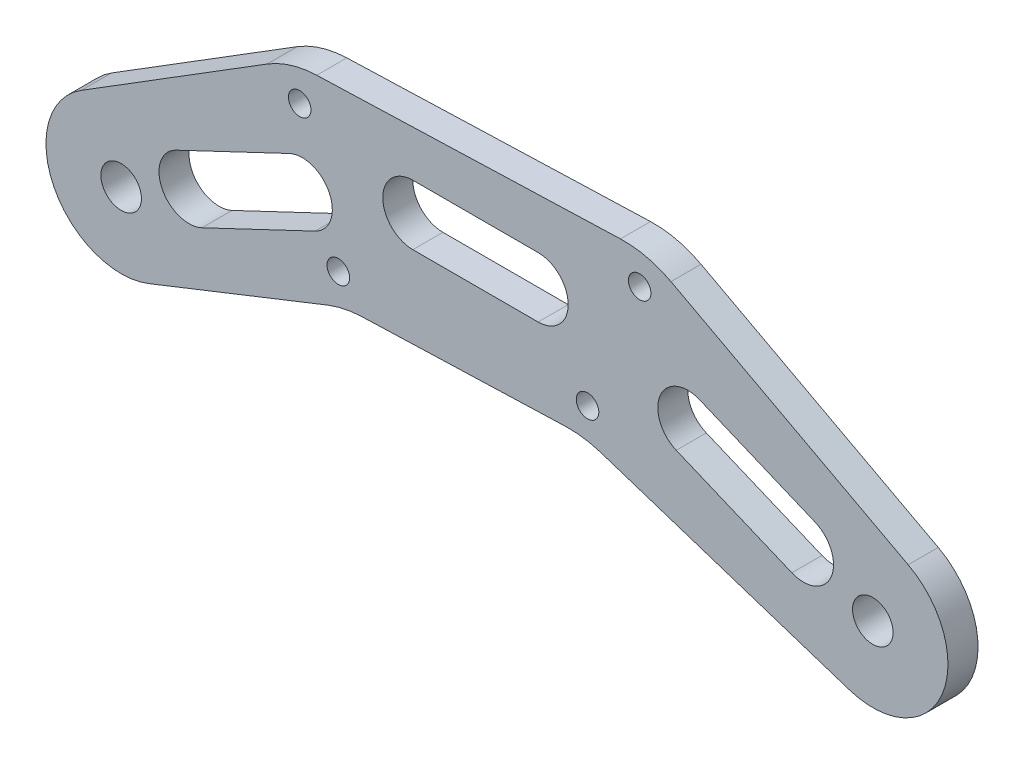
from build123d import *

# Parameters (mm, degrees)
SKETCH1_R                = 4.05
BOSS_EXTRUDE1_DEPTH      = 6
M4_CLEARANCE_HOLE1_D     = 4.5
M4_CLEARANCE_HOLE1_DEPTH = 80.96
M4_CLEARANCE_HOLE1_TIP   = 1.351936393
CUT_EXTRUDE1_DEPTH       = 103.314309644


with BuildPart() as part:
    # Sketch1 → Boss-Extrude1 (new body)
    with BuildSketch(Plane.XY):
        with BuildLine():
            Line((-65.19060966, -38.213571923), (-29.435009511, -24.059676563))
            ThreePointArc((-29.435009511, -24.059676563), (-26.147647316, -23.075006142), (-22.740346385, -22.666807174))
            Line((-22.740346385, -22.666807174), (18.034765948, -21.307032913))
            ThreePointArc((18.034765948, -21.307032913), (21.515927007, -21.494956503), (24.911568818, -22.284522385))
            Line((24.911568818, -22.284522385), (74.630790843, -38.525664943))
            ThreePointArc((74.630790843, -38.525664943), (93.086798158, -30.149764409), (86.35131748, -11.033979941))
            Line((86.35131748, -11.033979941), (39.011755224, 14.232375332))
            ThreePointArc((39.011755224, 14.232375332), (34.124223209, 16.06850435), (28.928004649, 16.57708242))
            Line((28.928004649, 16.57708242), (-31.672918815, 14.556154182))
            ThreePointArc((-31.672918815, 14.556154182), (-36.823710211, 13.702522548), (-41.578056522, 11.544854797))
            Line((-41.578056522, 11.544854797), (-78.64034873, -11.533366082))
            ThreePointArc((-78.64034873, -11.533366082), (-84.105870489, -31.018758249), (-65.19060966, -38.213571923))
        make_face()
        with Locations((-70.711551227, -24.266557754)):
            Circle(SKETCH1_R, mode=Mode.SUBTRACT)
        with Locations((79.288448772, -24.267115836)):
            Circle(SKETCH1_R, mode=Mode.SUBTRACT)
    extrude(amount=BOSS_EXTRUDE1_DEPTH)

    # M4 Clearance Hole1
    with Locations(Plane(origin=(-35.078495103, 7.961945554, 6), x_dir=(1, 0, 0), z_dir=(0, 0, 1))):
        with Locations((0, 0), (7.708679818, -25.162744902), (67.843830433, 2.262465733), (57.438792738, -23.51661265)):
            Hole(M4_CLEARANCE_HOLE1_D / 2, depth=M4_CLEARANCE_HOLE1_DEPTH)
            with Locations((0, 0, -(M4_CLEARANCE_HOLE1_DEPTH + M4_CLEARANCE_HOLE1_TIP / 2))):  # 118° drill point
                Cone(0, M4_CLEARANCE_HOLE1_D / 2, M4_CLEARANCE_HOLE1_TIP, mode=Mode.SUBTRACT)

    # Sketch4 → Cut-Extrude1 (cut, through all)
    with BuildSketch(Plane.XY.offset(6)):
        with BuildLine():
            Line((-59.730356843, -12.416942996), (-37.142655282, -1.702665692))
            ThreePointArc((-37.142655282, -1.702665692), (-29.150180354, -4.552287513), (-31.999802176, -12.544762441))
            Line((-31.999802176, -12.544762441), (-54.587503737, -23.259039746))
            ThreePointArc((-54.587503737, -23.259039746), (-62.579978665, -20.409417924), (-59.730356843, -12.416942996))
        make_face()
        with BuildLine():
            Line((63.134796659, -24.023141646), (40.065741433, -14.388895905))
            ThreePointArc((40.065741433, -14.388895905), (36.841387157, -6.540103673), (44.690179389, -3.315749397))
            Line((44.690179389, -3.315749397), (67.759234614, -12.949995138))
            ThreePointArc((67.759234614, -12.949995138), (70.983588891, -20.79878737), (63.134796659, -24.023141646))
        make_face()
        with BuildLine():
            Line((-12.5, 6), (12.5, 6))
            ThreePointArc((12.5, 6), (18.5, 0), (12.5, -6))
            Line((12.5, -6), (-12.5, -6))
            ThreePointArc((-12.5, -6), (-18.5, 0), (-12.5, 6))
        make_face()
    extrude(amount=-CUT_EXTRUDE1_DEPTH, mode=Mode.SUBTRACT)


solid = part.part
